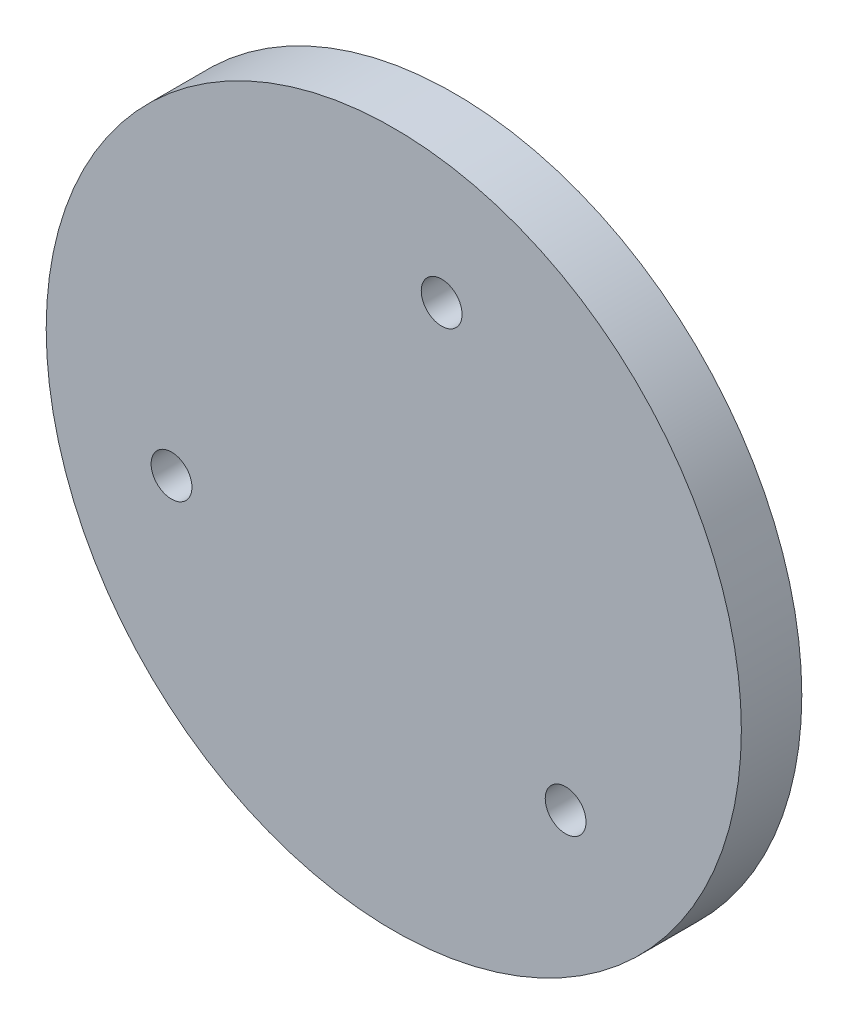
from build123d import *

# Parameters (mm, degrees)
ESQUISSE1_R             = 57.5
BOSS_EXTRU_1_DEPTH      = 10
ECHELLE1_SCALE          = 2
ECHELLE2_SCALE          = 0.25
ESQUISSE2_R             = 1.6875
ENL_V_MAT_EXTRU_1_DEPTH = 10


with BuildPart() as part:
    # Esquisse1 → Boss.-Extru.1 (new body)
    with BuildSketch(Plane.XY):
        Circle(ESQUISSE1_R)
    extrude(amount=BOSS_EXTRU_1_DEPTH)


with BuildPart() as part_1:
    # Echelle1: scaled about (0, 0, 5)
    add(part.part.scale(ECHELLE1_SCALE).moved(Location((0, 0, -5))))


with BuildPart() as part_2:
    # Echelle2: scaled about (0, 0, 5)
    add(part_1.part.scale(ECHELLE2_SCALE).moved(Location((0, 0, 3.75))))

    # Esquisse2 → Enlèv. mat.-Extru.1 (cut)
    with BuildSketch(Plane(origin=(0, 0, 2.5), x_dir=(-1, 0, 0), z_dir=(0, 0, -1))):
        with Locations((-3.959214709, 18.22761283)):
            Circle(ESQUISSE2_R)
        with Locations((18.38283853, -5.330774337)):
            Circle(ESQUISSE2_R)
        with Locations((-14.213467184, -13.006989818)):
            Circle(ESQUISSE2_R)
    extrude(amount=-ENL_V_MAT_EXTRU_1_DEPTH, mode=Mode.SUBTRACT)


solid = part_2.part
